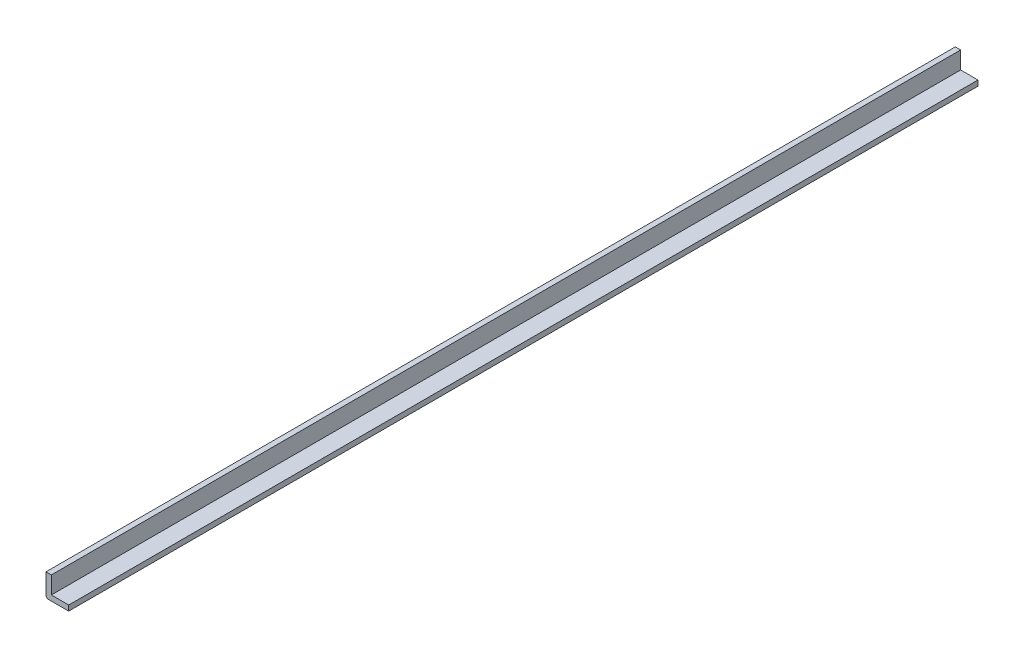
from build123d import *

# Parameters (mm, degrees)
BOSS_EXTRUDE1_DEPTH = 340.5
FILLET1_R           = 1


with BuildPart() as part:
    # Sketch1 → Boss-Extrude1 (new body)
    with BuildSketch(Plane.XY):
        Polygon((0, 0), (-8.5, 0), (-8.5, 8.5), (-6.5, 8.5), (-6.5, 2), (0, 2), align=None)
    extrude(amount=BOSS_EXTRUDE1_DEPTH)

    # Fillet1
    fillet1_edges = [part.edges().sort_by_distance(p)[0] for p in [
        (-8.5, 0, 170.25),
    ]]
    fillet(fillet1_edges, radius=FILLET1_R)


solid = part.part
